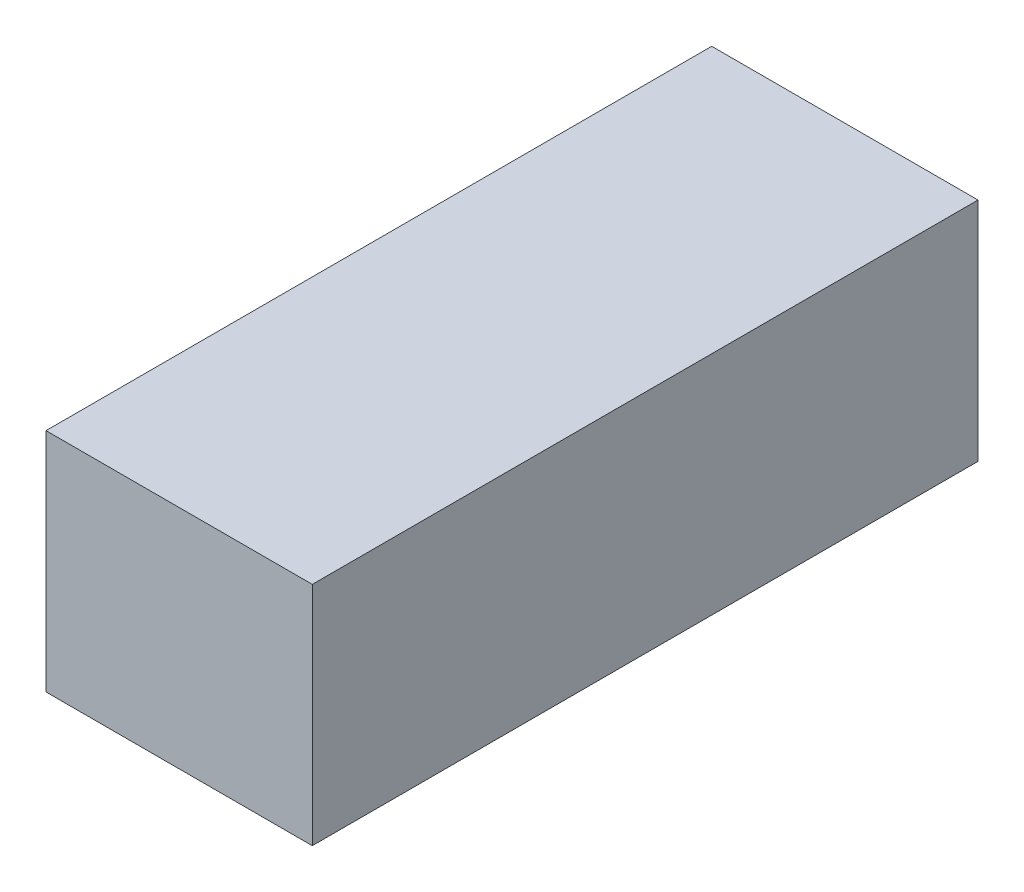
from build123d import *

# Parameters (mm, degrees)
SKETCH1_W           = 20
SKETCH1_H           = 50
BOSS_EXTRUDE1_DEPTH = 17


with BuildPart() as part:
    # Sketch1 → Boss-Extrude1 (new body)
    with BuildSketch(Plane(origin=(0, 0, 0), x_dir=(1, 0, 0), z_dir=(0, 1, 0))):
        with Locations((10, 25)):
            Rectangle(SKETCH1_W, SKETCH1_H)
    extrude(amount=BOSS_EXTRUDE1_DEPTH)


solid = part.part
